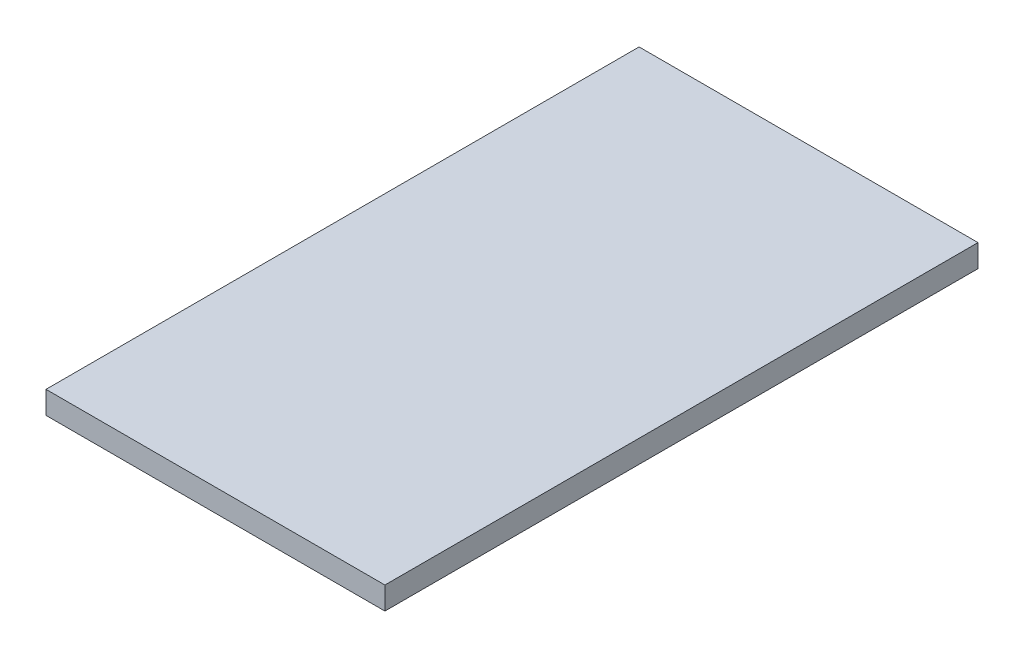
from build123d import *

# Parameters (mm, degrees)
SKETCH1_W           = 24
SKETCH1_H           = 42
BOSS_EXTRUDE1_DEPTH = 1.6


with BuildPart() as part:
    # Sketch1 → Boss-Extrude1 (new body)
    with BuildSketch(Plane(origin=(0, 0, 0), x_dir=(1, 0, 0), z_dir=(0, 1, 0))):
        with Locations((12, 21)):
            Rectangle(SKETCH1_W, SKETCH1_H)
    extrude(amount=BOSS_EXTRUDE1_DEPTH)


solid = part.part
